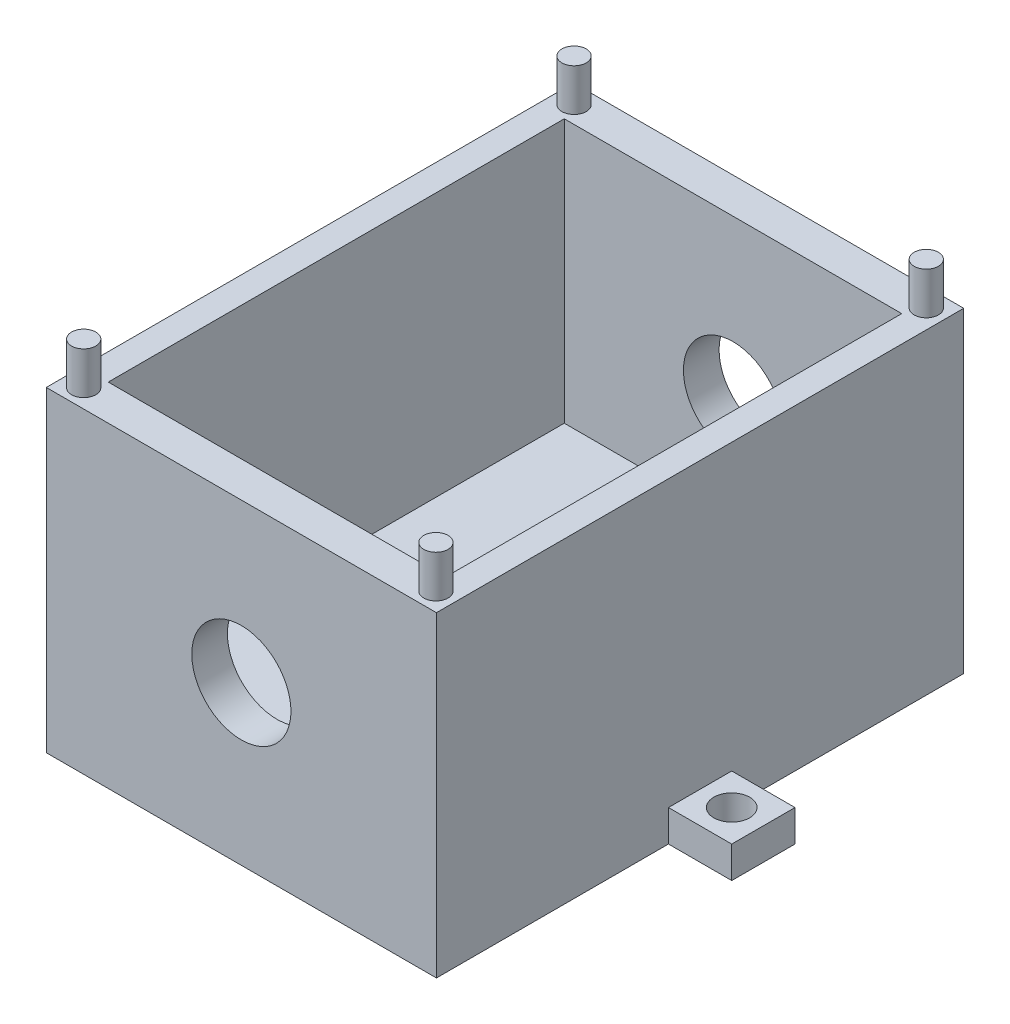
from build123d import *

# Parameters (mm, degrees)
SKETCH2_W           = 37
SKETCH2_H           = 50
SKETCH2_W_2         = 32
SKETCH2_H_2         = 43.243243244
BOSS_EXTRUDE1_DEPTH = 25
SKETCH4_W           = 37
SKETCH4_H           = 50
BOSS_EXTRUDE2_DEPTH = 5
SKETCH5_R           = 4.7
CUT_EXTRUDE1_DEPTH  = 65
SKETCH6_R           = 1.15
BOSS_EXTRUDE3_DEPTH = 4
SKETCH7_R           = 1.7
BOSS_EXTRUDE4_DEPTH = 3


with BuildPart() as part:
    # Sketch2 → Boss-Extrude1 (new body)
    with BuildSketch(Plane(origin=(0, 0, 0), x_dir=(1, 0, 0), z_dir=(0, 1, 0))):
        Rectangle(SKETCH2_W, SKETCH2_H)
        Rectangle(SKETCH2_W_2, SKETCH2_H_2, mode=Mode.SUBTRACT)
    extrude(amount=BOSS_EXTRUDE1_DEPTH)

    # Sketch4 → Boss-Extrude2 (add)
    with BuildSketch(Plane.XZ):
        Rectangle(SKETCH4_W, SKETCH4_H)
    extrude(amount=BOSS_EXTRUDE2_DEPTH)

    # Sketch5 → Cut-Extrude1 (cut)
    with BuildSketch(Plane(origin=(0, 0, -25), x_dir=(-1, 0, 0), z_dir=(0, 0, -1))):
        with Locations((0, 10)):
            Circle(SKETCH5_R)
    extrude(amount=-CUT_EXTRUDE1_DEPTH, mode=Mode.SUBTRACT)

    # Sketch6 → Boss-Extrude3 (add)
    with BuildSketch(Plane(origin=(0, 25, 0), x_dir=(1, 0, 0), z_dir=(0, 1, 0))):
        with Locations(Location((-16.7, 23.25, 0), (0, 0, 270))):
            Circle(SKETCH6_R)
        with Locations(Location((16.7, 23.25, 0), (0, 0, 90))):
            Circle(SKETCH6_R)
        with Locations(Location((16.7, -23.25, 0), (0, 0, 270))):
            Circle(SKETCH6_R)
        with Locations(Location((-16.7, -23.25, 0), (0, 0, 90))):
            Circle(SKETCH6_R)
    extrude(amount=BOSS_EXTRUDE3_DEPTH)

    # Sketch7 → Boss-Extrude4 (add)
    with BuildSketch(Plane.XZ.offset(5)):
        Polygon((-18.5, 0), (-18.5, 3), (-24.5, 3), (-24.5, -3), (-18.5, -3), align=None)
        with Locations(Location((-21.5, 0, 0), (0, 0, 270))):
            Circle(SKETCH7_R, mode=Mode.SUBTRACT)
    boss_extrude4 = extrude(amount=-BOSS_EXTRUDE4_DEPTH)

    # Mirror1: Boss-Extrude4 across plane
    add(boss_extrude4.mirror(Plane(origin=(0, 0, 0), x_dir=(0, 0, 1), z_dir=(1, 0, 0))))


solid = part.part
